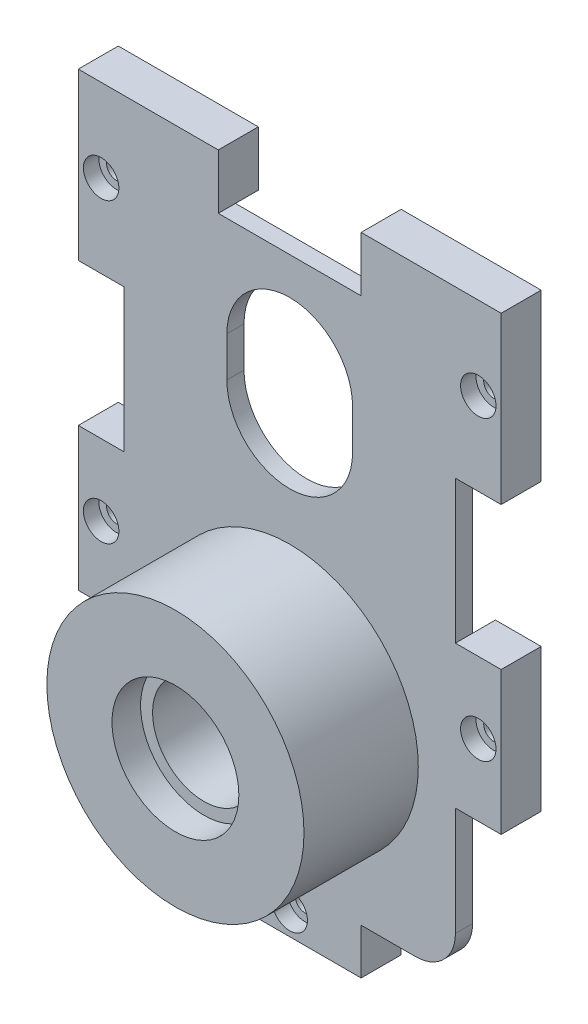
from build123d import *

# Parameters (mm, degrees)
CROQUIS2_R              = 22.5
SALIENTE_EXTRUIR1_DEPTH = 7
CROQUIS2_4_R            = 11.1
CROQUIS2_4_R_2          = 9
SALIENTE_EXTRUIR2_DEPTH = 22
CROQUIS2_5_R            = 22.5
CROQUIS2_5_R_2          = 11.1
SALIENTE_EXTRUIR3_DEPTH = 27
CROQUIS3_R              = 1.75
CORTAR_EXTRUIR1_DEPTH   = 7
CROQUIS4_R              = 3.1
CORTAR_EXTRUIR2_DEPTH   = 2.7
CROQUIS5_R              = 9
CORTAR_EXTRUIR3_DEPTH   = 4


with BuildPart() as part:
    # Croquis2 → Saliente-Extruir1 (new body)
    with BuildSketch(Plane.XY):
        with BuildLine():
            Line((-30.786620614, 39.205288522), (-30.786620614, 48.816010109))
            Line((-30.786620614, 48.816010109), (-55.286620614, 48.816010109))
            Line((-55.286620614, 48.816010109), (-55.286620614, 19.816010109))
            Line((-55.286620614, 19.816010109), (-47.286620614, 19.816010109))
            Line((-47.286620614, 19.816010109), (-47.286620614, -5.183989891))
            Line((-47.286620614, -5.183989891), (-55.286620614, -5.183989891))
            Line((-55.286620614, -5.183989891), (-55.286620614, -30.183989891))
            Line((-55.286620614, -30.183989891), (-47.286620614, -30.183989891))
            Line((-47.286620614, -30.183989891), (-47.286620614, -49.183989891))
            ThreePointArc((-47.286620614, -49.183989891), (-45.236368082, -54.133737359), (-40.286620614, -56.183989891))
            Line((-40.286620614, -56.183989891), (-30.786620614, -56.183989891))
            Line((-30.786620614, -56.183989891), (-30.786620614, -64.183989891))
            Line((-30.786620614, -64.183989891), (-5.786620614, -64.183989891))
            Line((-5.786620614, -64.183989891), (-5.786620614, -56.183989891))
            Line((-5.786620614, -56.183989891), (3.713379386, -56.183989891))
            ThreePointArc((3.713379386, -56.183989891), (8.663126854, -54.133737359), (10.713379386, -49.183989891))
            Line((10.713379386, -49.183989891), (10.713379386, -30.183989891))
            Line((10.713379386, -30.183989891), (18.713379386, -30.183989891))
            Line((18.713379386, -30.183989891), (18.713379386, -5.183989891))
            Line((18.713379386, -5.183989891), (10.713379386, -5.183989891))
            Line((10.713379386, -5.183989891), (10.713379386, 19.816010109))
            Line((10.713379386, 19.816010109), (18.713379386, 19.816010109))
            Line((18.713379386, 19.816010109), (18.713379386, 48.816010109))
            Line((18.713379386, 48.816010109), (-5.786620614, 48.816010109))
            Line((-5.786620614, 48.816010109), (-5.786620614, 39.205288522))
            Line((-5.786620614, 39.205288522), (-30.786620614, 39.205288522))
        make_face()
        with BuildLine():
            ThreePointArc((-7.286620614, 14.705288522), (-18.286620614, 3.705288522), (-29.286620614, 14.705288522))
            Line((-29.286620614, 14.705288522), (-29.286620614, 21.705288522))
            ThreePointArc((-29.286620614, 21.705288522), (-18.286620614, 32.705288522), (-7.286620614, 21.705288522))
            Line((-7.286620614, 21.705288522), (-7.286620614, 14.705288522))
        make_face(mode=Mode.SUBTRACT)
        with Locations((-18.286620614, -27.183989891)):
            Circle(CROQUIS2_R, mode=Mode.SUBTRACT)
    extrude(amount=SALIENTE_EXTRUIR1_DEPTH)



with BuildPart() as body_2:
    # Croquis2<4> → Saliente-Extruir2 (new body)
    with BuildSketch(Plane.XY):
        with Locations((-18.286620614, -27.183989891)):
            Circle(CROQUIS2_4_R)
        with Locations((-18.286620614, -27.183989891)):
            Circle(CROQUIS2_4_R_2, mode=Mode.SUBTRACT)
    extrude(amount=SALIENTE_EXTRUIR2_DEPTH)


with BuildPart() as part_1:
    add(part.part)

    add(body_2.part)  # Saliente-Extruir3 merges body 2
    # Croquis2<5> → Saliente-Extruir3 (add)
    with BuildSketch(Plane.XY):
        with Locations((-18.286620614, -27.183989891)):
            Circle(CROQUIS2_5_R)
        with Locations((-18.286620614, -27.183989891)):
            Circle(CROQUIS2_5_R_2, mode=Mode.SUBTRACT)
    extrude(amount=SALIENTE_EXTRUIR3_DEPTH)

    # Croquis3 → Cortar-Extruir1 (cut)
    with BuildSketch(Plane.XY.offset(7)):
        with Locations((-51.286620614, 34.316010109)):
            Circle(CROQUIS3_R)
        with Locations((-51.286620614, -17.683989891)):
            Circle(CROQUIS3_R)
        with Locations((-18.286620614, -60.183989891)):
            Circle(CROQUIS3_R)
        with Locations((14.713379386, -17.683989891)):
            Circle(CROQUIS3_R)
        with Locations((14.713379386, 34.316010109)):
            Circle(CROQUIS3_R)
    extrude(amount=-CORTAR_EXTRUIR1_DEPTH, mode=Mode.SUBTRACT)

    # Croquis4 → Cortar-Extruir2 (cut)
    with BuildSketch(Plane.XY.offset(7)):
        with Locations((-51.286620614, -17.683989891)):
            Circle(CROQUIS4_R)
        with Locations((-51.286620614, 34.316010109)):
            Circle(CROQUIS4_R)
        with Locations((14.713379386, 34.316010109)):
            Circle(CROQUIS4_R)
        with Locations((14.713379386, -17.683989891)):
            Circle(CROQUIS4_R)
        with Locations((-18.286620614, -60.183989891)):
            Circle(CROQUIS4_R)
    extrude(amount=-CORTAR_EXTRUIR2_DEPTH, mode=Mode.SUBTRACT)

    # Croquis5 → Cortar-Extruir3 (cut)
    with BuildSketch(Plane(origin=(0, 0, 0), x_dir=(-1, 0, 0), z_dir=(0, 0, -1))):
        with BuildLine():
            Line((47.286620614, 39.205288522), (-10.713379386, 39.205288522))
            Line((-10.713379386, 39.205288522), (-10.713379386, -49.183989891))
            ThreePointArc((-10.713379386, -49.183989891), (-8.663126854, -54.133737359), (-3.713379386, -56.183989891))
            Line((-3.713379386, -56.183989891), (40.286620614, -56.183989891))
            ThreePointArc((40.286620614, -56.183989891), (45.236368082, -54.133737359), (47.286620614, -49.183989891))
            Line((47.286620614, -49.183989891), (47.286620614, 39.205288522))
        make_face()
        with BuildLine():
            Line((7.286620614, 14.705288522), (7.286620614, 21.705288522))
            ThreePointArc((7.286620614, 21.705288522), (18.286620614, 32.705288522), (29.286620614, 21.705288522))
            Line((29.286620614, 21.705288522), (29.286620614, 14.705288522))
            ThreePointArc((29.286620614, 14.705288522), (18.286620614, 3.705288522), (7.286620614, 14.705288522))
        make_face(mode=Mode.SUBTRACT)
        with Locations((18.286620614, -27.183989891)):
            Circle(CROQUIS5_R, mode=Mode.SUBTRACT)
    extrude(amount=-CORTAR_EXTRUIR3_DEPTH, mode=Mode.SUBTRACT)


solid = part_1.part
